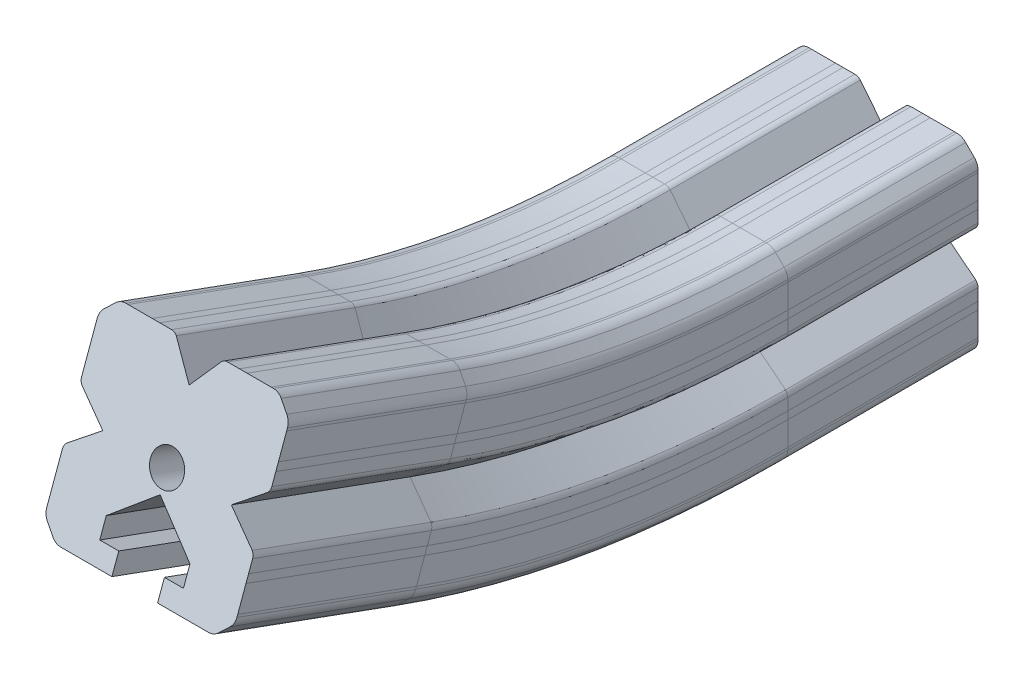
from build123d import *

# Parameters (mm, degrees)
SKETCH12_R         = 3.3274
CUT_EXTRUDE3_DEPTH = 16.51
SKETCH16_R         = 3.3274
CUT_EXTRUDE5_DEPTH = 16.51
CUT_EXTRUDE6_DEPTH = 38.1
CUT_EXTRUDE7_DEPTH = 38.1
FILLET1_R          = 2.54


with BuildPart() as part:
    # Sweep4: sweep along a path in Sketch2
    with BuildLine(Plane(origin=(0, 0, 0), x_dir=(0, -1, 0), z_dir=(1, 0, 0))) as sweep4_path:
        Line((0, 304.8), (0, 266.7))
        ThreePointArc((0, 266.7), (-3.087064588, 231.414690298), (-12.254459456, 197.201506876))
        Line((-12.254459456, 197.201506876), (-25.285426917, 161.399218024))
    # Sketch1 → Sweep4 (sweep)
    with BuildSketch(Plane(origin=(0, 0, -304.8), x_dir=(-1, 0, 0), z_dir=(0, 0, -1))):
        with BuildLine():
            Line((14.327719385, 19.117037436), (9.498178882, 19.117037436))
            Line((9.498178882, 19.117037436), (7.974178882, 19.117037436))
            Line((7.974178882, 19.117037436), (5.617617743, 19.117037436))
            add(Edge.make_bspline(
                [(4.519044239, 18.661993391), (4.974146533, 19.106441591), (5.617617743, 19.117037436)],
                knots=[0, 0, 0, 1, 1, 1], degree=2))
            Line((4.519044239, 18.661993391), (1.94e-07, 12.981797177))
            Line((1.94e-07, 12.981797177), (-4.519043851, 18.661993391))
            add(Edge.make_bspline(
                [(-4.519043851, 18.661993391), (-4.974146145, 19.106441591), (-5.617617355, 19.117037436)],
                knots=[0, 0, 0, 1, 1, 1], degree=2))
            Line((-5.617617355, 19.117037436), (-7.974178525, 19.117037436))
            Line((-7.974178525, 19.117037436), (-9.498178525, 19.117037436))
            Line((-9.498178525, 19.117037436), (-14.327719028, 19.117037436))
            Line((-14.327719028, 19.117037436), (-15.847486861, 19.117037436))
            Line((-15.847486861, 19.117037436), (-19.049999993, 15.914546869))
            Line((-19.049999993, 15.914546869), (-19.049999993, 14.394779143))
            Line((-19.049999993, 14.394779143), (-19.049999993, 9.563129129))
            Line((-19.049999993, 9.563129129), (-19.049999993, 8.043361318))
            Line((-19.049999993, 8.043361318), (-19.049999993, 5.684655209))
            add(Edge.make_bspline(
                [(-18.594955948, 4.586081704), (-19.037616587, 5.0374273), (-19.049999993, 5.684655209)],
                knots=[0, 0, 0, 1, 1, 1], degree=2))
            Line((-18.594955948, 4.586081704), (-12.87844311, 0.067037659))
            Line((-12.87844311, 0.067037659), (-18.594955948, -4.452006385))
            add(Edge.make_bspline(
                [(-18.594955948, -4.452006385), (-19.041321191, -4.911567946), (-19.049999993, -5.55057989)],
                knots=[0, 0, 0, 1, 1, 1], degree=2))
            Line((-19.049999993, -5.55057989), (-19.049999993, -7.909280831))
            Line((-19.049999993, -7.909280831), (-19.049999993, -9.429048642))
            Line((-19.049999993, -9.429048642), (-19.049999993, -14.26070525))
            Line((-19.049999993, -14.26070525), (-19.049999993, -15.78047301))
            Line((-19.049999993, -15.78047301), (-15.847487724, -18.982963187))
            Line((-15.847487724, -18.982963187), (-14.327719934, -18.982963187))
            Line((-14.327719934, -18.982963187), (-9.496063347, -18.982963187))
            Line((-9.496063347, -18.982963187), (-7.976295515, -18.982963187))
            Line((-7.976295515, -18.982963187), (-5.617618448, -18.982963187))
            Line((-5.617618448, -18.982963187), (5.61761665, -18.982963187))
            Line((5.61761665, -18.982963187), (7.976293717, -18.982963187))
            Line((7.976293717, -18.982963187), (9.49606155, -18.982963187))
            Line((9.49606155, -18.982963187), (14.327718136, -18.982963187))
            Line((14.327718136, -18.982963187), (15.847485969, -18.982963187))
            Line((15.847485969, -18.982963187), (19.049999872, -15.780473094))
            Line((19.049999872, -15.780473094), (19.049999872, -14.260705341))
            Line((19.049999872, -14.260705341), (19.049999872, -9.429048733))
            Line((19.049999872, -9.429048733), (19.049999872, -7.909280921))
            Line((19.049999872, -7.909280921), (19.049999872, -5.55057989))
            add(Edge.make_bspline(
                [(18.594955827, -4.452006385), (19.032827661, -4.894662271), (19.049999872, -5.55057989)],
                knots=[0, 0, 0, 1, 1, 1], degree=2))
            Line((18.594955827, -4.452006385), (12.878443126, 0.067037659))
            Line((12.878443126, 0.067037659), (18.50654198, 4.504271816))
            add(Edge.make_bspline(
                [(18.50654198, 4.504271816), (19.035090049, 4.971481948), (19.049999872, 5.684655209)],
                knots=[0, 0, 0, 1, 1, 1], degree=2))
            Line((19.049999872, 5.684655209), (19.049999872, 8.043361226))
            Line((19.049999872, 8.043361226), (19.049999872, 9.563129038))
            Line((19.049999872, 9.563129038), (19.049999872, 14.394779052))
            Line((19.049999872, 14.394779052), (19.049999872, 15.914546875))
            Line((19.049999872, 15.914546875), (15.847487218, 19.117037436))
            Line((15.847487218, 19.117037436), (14.327719385, 19.117037436))
        make_face()
    sweep(path=sweep4_path.line)

    # Sketch12 → Cut-Extrude3 (cut)
    with BuildSketch(Plane(origin=(0, 0, -304.8), x_dir=(-1, 0, 0), z_dir=(0, 0, -1))):
        with Locations((8e-09, 0.067037659)):
            Circle(SKETCH12_R)
    extrude(amount=-CUT_EXTRUDE3_DEPTH, mode=Mode.SUBTRACT)

    # Sketch16 → Cut-Extrude5 (cut)
    with BuildSketch(Plane(origin=(0, -48.914875712, -134.392516494), x_dir=(1, 0, 0), z_dir=(0, 0.342020143325655, 0.9396926207859133))):
        with Locations(Location((-8e-09, 79.029350428, 0), (0, 0, 270))):
            Circle(SKETCH16_R)
    extrude(amount=-CUT_EXTRUDE5_DEPTH, mode=Mode.SUBTRACT)

    # Sketch10 → Cut-Extrude6 (cut)
    with BuildSketch(Plane(origin=(0, 0, -304.8), x_dir=(-1, 0, 0), z_dir=(0, 0, -1))):
        Polygon((4.572, -18.982963187), (4.572, -14.969763187), (8.382, -14.969763187), (8.382, -11.159763187), (0, -4.126430078), (-8.382, -11.159763187), (-8.382, -14.969763187), (-4.572, -14.969763187), (-4.572, -18.982963187), align=None)
    extrude(amount=-CUT_EXTRUDE6_DEPTH, mode=Mode.SUBTRACT)

    # Sketch17 → Cut-Extrude7 (cut)
    with BuildSketch(Plane(origin=(0, -48.914875712, -134.392516494), x_dir=(1, 0, 0), z_dir=(0, 0.342020143325655, 0.9396926207859134))):
        Polygon((4.610822369, 59.979349582), (-4.533177631, 59.979349582), (-4.533177631, 63.992549582), (-8.343177631, 63.992549582), (-8.343177631, 67.802549582), (0.038822369, 74.83588269), (8.420822369, 67.802549582), (8.420822369, 63.992549582), (4.610822369, 63.992549582), align=None)
    extrude(amount=-CUT_EXTRUDE7_DEPTH, mode=Mode.SUBTRACT)

    # Fillet1
    fillet1_edges = [part.edges().sort_by_distance(p)[0] for p in [
        (15.847486861, 19.117037436, -285.75),
        (19.049999993, 15.914546869, -285.75),
        (19.049999993, -15.78047301, -285.75),
        (15.847487724, -18.982963187, -285.75),
        (-15.847485969, -18.982963187, -285.75),
        (-19.049999872, -15.780473094, -285.75),
        (-19.049999872, 15.914546875, -285.75),
        (-15.847487218, 19.117037436, -285.75),
        (15.847486861, 21.91367127, -234.734329011),
        (19.049999993, 18.75983373, -234.17822236),
        (19.049999993, -12.453667579, -228.674439917),
        (15.847487724, -15.607504734, -228.118333334),
        (-15.847485969, -15.607504734, -228.118333334),
        (-19.049999872, -12.453667661, -228.674439903),
        (-19.049999872, 18.759833736, -234.178222361),
        (-15.847487218, 21.91367127, -234.734329011),
        (15.847486861, 36.734082197, -185.838774334),
        (19.049999993, 33.724725443, -184.743458051),
        (19.049999993, 3.941149146, -173.90312281),
        (15.847487724, 0.931792759, -172.80780666),
        (-15.847485969, 0.931792759, -172.80780666),
        (-19.049999872, 3.941149068, -173.903122781),
        (-19.049999872, 33.724725448, -184.743458053),
        (-15.847487218, 36.734082197, -185.838774334),
    ]]
    fillet(fillet1_edges, radius=FILLET1_R)


solid = part.part
